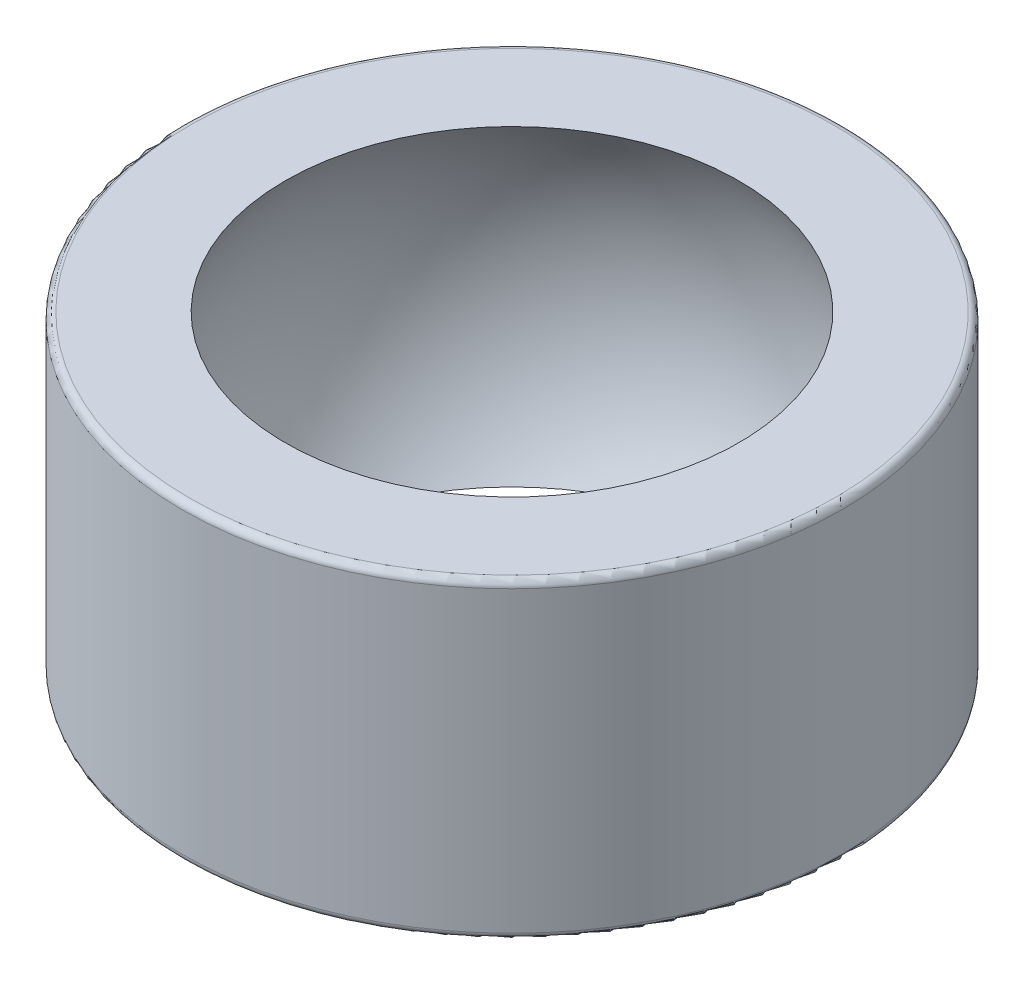
from build123d import *

# Parameters (mm, degrees)
SZKIC1_R                    = 9.5
DODANIE_WYCI_GNI_CIE1_DEPTH = 4.5
ZAOKR_GLENIE1_R             = 0.2


with BuildPart() as part:
    # Szkic1 → Dodanie-wyciągnięcie1 (new, symmetric)
    with BuildSketch(Plane(origin=(0, 0, 0), x_dir=(1, 0, 0), z_dir=(0, 1, 0))):
        with Locations(Location((0, 0, 0), (0, 0, 270))):
            Circle(SZKIC1_R)
    extrude(amount=DODANIE_WYCI_GNI_CIE1_DEPTH, both=True)

    # Szkic3 → Wycięcie-obrót1 (revolve, cut)
    with BuildSketch(Plane.XY):
        with BuildLine():
            Line((0, -7.94), (0, 7.94))
            ThreePointArc((0, 7.94), (7.94, 0), (0, -7.94))
        make_face()
    revolve(axis=Axis((0, -7.94, 0), (0, 1, 0)), mode=Mode.SUBTRACT)

    # Zaokrąglenie1
    zaokr_glenie1_edges = [part.edges().sort_by_distance(p)[0] for p in [
        (0, -4.5, -9.5),
        (0, 4.5, -9.5),
    ]]
    fillet(zaokr_glenie1_edges, radius=ZAOKR_GLENIE1_R)


solid = part.part
